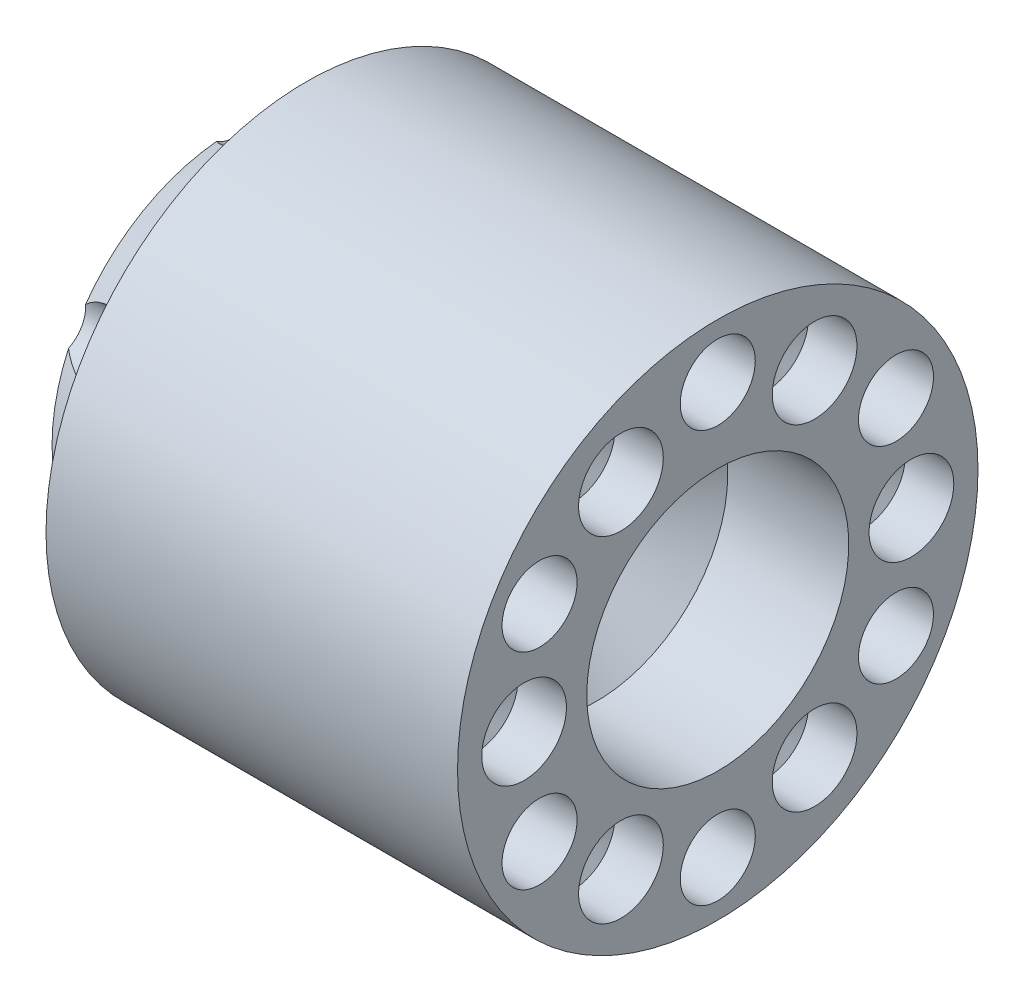
from build123d import *

# Parameters (mm, degrees)
SKETCH11_R                   = 3.1
EXTRUDE1_DEPTH               = 12
M6_TAPPED_HOLE1_D            = 5
M6_TAPPED_HOLE1_DEPTH        = 35
M6_TAPPED_HOLE1_TIP          = 1.502151548
F_7_0_7_DIAMETER_HOLE1_D     = 7
F_7_0_7_DIAMETER_HOLE1_DEPTH = 4
F_7_0_7_DIAMETER_HOLE1_TIP   = 2.103012167
EXTRUDE3_DEPTH               = 3.5


with BuildPart() as part:
    # Sketch1 → Revolve1 (revolve)
    with BuildSketch(Plane.XY, mode=Mode.PRIVATE) as revolve1_sk:
        Polygon((6, 18.5), (0, 15), (0, 9.0675), (25.675, 6.5), (30, 10.825), (40, 10.825), (40, 21.5), (6, 21.5), align=None)
    revolve(revolve1_sk.sketch.rotate(Axis((0, 0, 0), (1, 0, 0)), 90), axis=Axis((0, 0, 0), (1, 0, 0)))

    # Sketch11 → Extrude1 (cut)
    with BuildSketch(Plane(origin=(40, 0, 0), x_dir=(0, 0, -1), z_dir=(1, 0, 0))):
        with Locations((0, -17)):
            Circle(SKETCH11_R)
        with Locations((-14.722431864, -8.5)):
            Circle(SKETCH11_R)
        with Locations((-14.722431864, 8.5)):
            Circle(SKETCH11_R)
        with Locations((0, 17)):
            Circle(SKETCH11_R)
        with Locations((14.722431864, 8.5)):
            Circle(SKETCH11_R)
        with Locations((14.722431864, -8.5)):
            Circle(SKETCH11_R)
    extrude(amount=-EXTRUDE1_DEPTH, mode=Mode.SUBTRACT)

    # M6 Tapped Hole1
    with Locations(Plane(origin=(28, -17, 0), x_dir=(0, 0, 1), z_dir=(1, 0, 0))):
        with Locations((0, 0), (14.722431864, -8.5), (14.722431864, -25.5), (0, -34), (-14.722431864, -25.5), (-14.722431864, -8.5)):
            Hole(M6_TAPPED_HOLE1_D / 2, depth=M6_TAPPED_HOLE1_DEPTH)
            with Locations((0, 0, -(M6_TAPPED_HOLE1_DEPTH + M6_TAPPED_HOLE1_TIP / 2))):  # 118° drill point
                Cone(0, M6_TAPPED_HOLE1_D / 2, M6_TAPPED_HOLE1_TIP, mode=Mode.SUBTRACT)

    # Ø7.0 (7) Diameter Hole1
    with Locations(Plane(origin=(40, -13.856406461, -8), x_dir=(0, 0, 1), z_dir=(1, 0, 0))):
        with Locations((0, 0), (16, 0), (24, -13.856406461), (16, -27.712812922), (0, -27.712812922), (-8, -13.856406461)):
            Hole(F_7_0_7_DIAMETER_HOLE1_D / 2, depth=F_7_0_7_DIAMETER_HOLE1_DEPTH)
            with Locations((0, 0, -(F_7_0_7_DIAMETER_HOLE1_DEPTH + F_7_0_7_DIAMETER_HOLE1_TIP / 2))):  # 118° drill point
                Cone(0, F_7_0_7_DIAMETER_HOLE1_D / 2, F_7_0_7_DIAMETER_HOLE1_TIP, mode=Mode.SUBTRACT)

    # Sketch18 → Extrude3 (cut, symmetric)
    with BuildSketch(Plane.XY):
        Polygon((28.570558224, 5.305955372), (-3.074664918, 8.470477686), (-2.776153761, 11.455589257), (28.869069381, 8.291066942), align=None)
    extrude(amount=EXTRUDE3_DEPTH, both=True, mode=Mode.SUBTRACT)


solid = part.part
